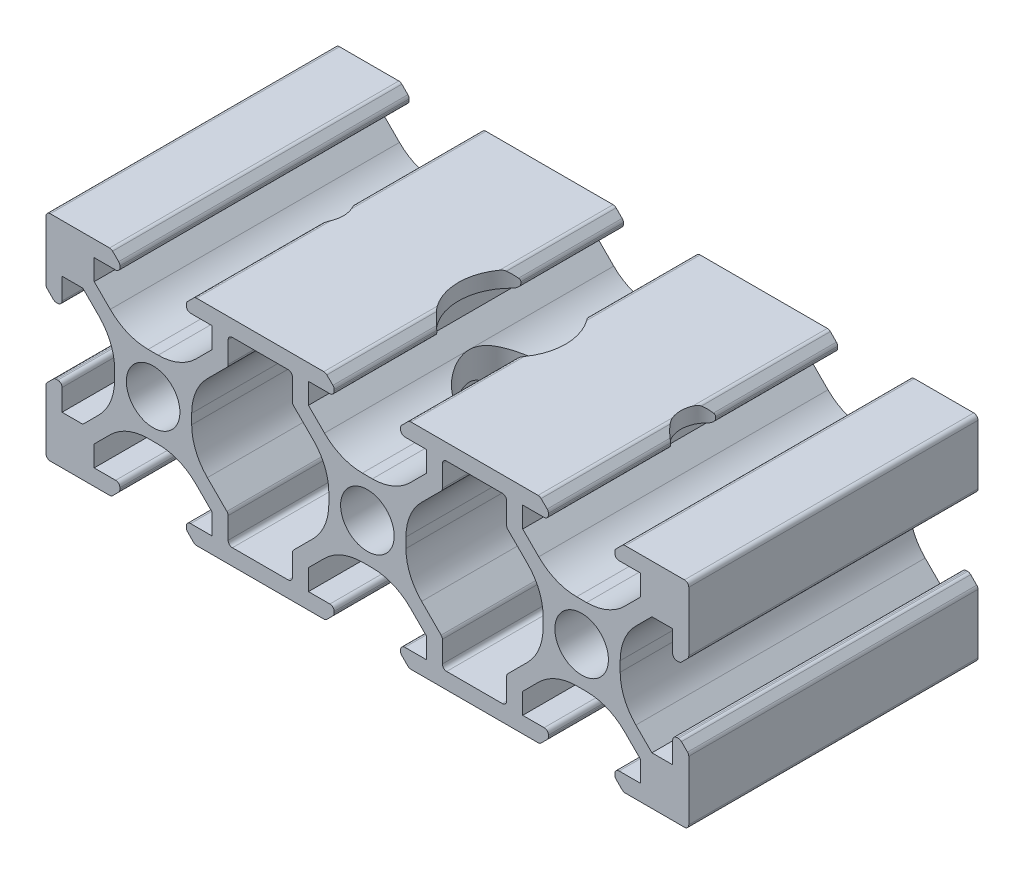
from build123d import *

# Parameters (mm, degrees)
RESSALTO_EXTRUS_O1_DEPTH    = 27
PADR_OCIRCULAR1_COUNT       = 4
PADR_O_LINEAR1_COUNT        = 3
PADR_O_LINEAR1_PITCH        = 20
PADR_O_LINEAR1_COPY_1_DEPTH = 27
PADR_O_LINEAR1_COPY_2_DEPTH = 27
PADR_O_LINEAR1_COPY_3_DEPTH = 27
PADR_O_LINEAR1_COPY_4_DEPTH = 27
PADR_O_LINEAR1_COPY_5_DEPTH = 27
PADR_O_LINEAR1_COPY_6_DEPTH = 27
CORTE_EXTRUS_O1_DEPTH       = 58.697486947
PADR_O_LINEAR2_COUNT        = 2
PADR_O_LINEAR2_PITCH        = 20
FILETE1_R                   = 0.4
FILETE2_R                   = 0.4
SKETCH1_R                   = 5
SKETCH1_R_2                 = 2.5
CUT_EXTRUDE1_DEPTH          = 3
SKETCH2_R                   = 4
CUT_EXTRUDE2_DEPTH          = 61.241181972


with BuildPart() as part:
    # Esboço1 → Ressalto-extrusão1 (new body)
    with BuildSketch(Plane.XY):
        with BuildLine():
            ThreePointArc((-9.317157288, 3.217157288), (-9.187387948, 3.130448187), (-9.034314575, 3.1))
            Line((-9.034314575, 3.1), (-8.9, 3.1))
            ThreePointArc((-8.9, 3.1), (-8.617157288, 3.217157288), (-8.5, 3.5))
            Line((-8.5, 3.5), (-8.5, 5.5))
            Line((-8.5, 5.5), (-6.560660172, 5.5))
            Line((-6.560660172, 5.5), (-5.064466094, 4.003805922))
            ThreePointArc((-5.064466094, 4.003805922), (-3.980602337, 2.381689178), (-3.6, 0.468272016))
            Line((-3.6, 0.468272016), (-3.6, 0))
            Line((-3.6, 0), (-2.5, 0))
            ThreePointArc((-2.5, 0), (-1.767766953, 1.767766953), (0, 2.5))
            Line((0, 2.5), (0, 3.6))
            Line((0, 3.6), (-0.468272016, 3.6))
            ThreePointArc((-0.468272016, 3.6), (-2.381689178, 3.980602337), (-4.003805922, 5.064466094))
            Line((-4.003805922, 5.064466094), (-5.5, 6.560660172))
            Line((-5.5, 6.560660172), (-5.5, 8.5))
            Line((-5.5, 8.5), (-3.5, 8.5))
            ThreePointArc((-3.5, 8.5), (-3.217157288, 8.617157288), (-3.1, 8.9))
            Line((-3.1, 8.9), (-3.1, 9.034314575))
            ThreePointArc((-3.1, 9.034314575), (-3.130448187, 9.187387948), (-3.217157288, 9.317157288))
            Line((-3.217157288, 9.317157288), (-3.782842712, 9.882842712))
            ThreePointArc((-3.782842712, 9.882842712), (-3.912612052, 9.969551813), (-4.065685425, 10))
            Line((-4.065685425, 10), (-10, 10))
            Line((-10, 10), (-10, 4.065685425))
            ThreePointArc((-10, 4.065685425), (-9.969551813, 3.912612052), (-9.882842712, 3.782842712))
            Line((-9.882842712, 3.782842712), (-9.317157288, 3.217157288))
        make_face()
    ressalto_extrus_o1 = extrude(amount=RESSALTO_EXTRUS_O1_DEPTH)

    # PadrãoCircular1: Ressalto-extrusão1 ×4 about axis
    padr_ocircular1_axis = Axis((0, 0, 0), (0, 0, 1))
    for i in range(1, PADR_OCIRCULAR1_COUNT):
        add(ressalto_extrus_o1.rotate(padr_ocircular1_axis, i * 360 / PADR_OCIRCULAR1_COUNT))

    # Padrão linear1: Ressalto-extrusão1 ×3
    with Locations(*[(i * PADR_O_LINEAR1_PITCH, 0, 0) for i in range(1, PADR_O_LINEAR1_COUNT)]):
        add(ressalto_extrus_o1)

    # Padrão linear1 copy 1 sketch → Padrão linear1 copy 1 (add)
    with BuildSketch(Plane(origin=(20, 0, 0), x_dir=(0, 1, 0), z_dir=(0, 0, 1))):
        with BuildLine():
            ThreePointArc((-9.317157288, 3.217157288), (-9.187387948, 3.130448187), (-9.034314575, 3.1))
            Line((-9.034314575, 3.1), (-8.9, 3.1))
            ThreePointArc((-8.9, 3.1), (-8.617157288, 3.217157288), (-8.5, 3.5))
            Line((-8.5, 3.5), (-8.5, 5.5))
            Line((-8.5, 5.5), (-6.560660172, 5.5))
            Line((-6.560660172, 5.5), (-5.064466094, 4.003805922))
            ThreePointArc((-5.064466094, 4.003805922), (-3.980602337, 2.381689178), (-3.6, 0.468272016))
            Line((-3.6, 0.468272016), (-3.6, 0))
            Line((-3.6, 0), (-2.5, 0))
            ThreePointArc((-2.5, 0), (-1.767766953, 1.767766953), (0, 2.5))
            Line((0, 2.5), (0, 3.6))
            Line((0, 3.6), (-0.468272016, 3.6))
            ThreePointArc((-0.468272016, 3.6), (-2.381689178, 3.980602337), (-4.003805922, 5.064466094))
            Line((-4.003805922, 5.064466094), (-5.5, 6.560660172))
            Line((-5.5, 6.560660172), (-5.5, 8.5))
            Line((-5.5, 8.5), (-3.5, 8.5))
            ThreePointArc((-3.5, 8.5), (-3.217157288, 8.617157288), (-3.1, 8.9))
            Line((-3.1, 8.9), (-3.1, 9.034314575))
            ThreePointArc((-3.1, 9.034314575), (-3.130448187, 9.187387948), (-3.217157288, 9.317157288))
            Line((-3.217157288, 9.317157288), (-3.782842712, 9.882842712))
            ThreePointArc((-3.782842712, 9.882842712), (-3.912612052, 9.969551813), (-4.065685425, 10))
            Line((-4.065685425, 10), (-10, 10))
            Line((-10, 10), (-10, 4.065685425))
            ThreePointArc((-10, 4.065685425), (-9.969551813, 3.912612052), (-9.882842712, 3.782842712))
            Line((-9.882842712, 3.782842712), (-9.317157288, 3.217157288))
        make_face()
    extrude(amount=PADR_O_LINEAR1_COPY_1_DEPTH)

    # Padrão linear1 copy 2 sketch → Padrão linear1 copy 2 (add)
    with BuildSketch(Plane(origin=(40, 0, 0), x_dir=(0, 1, 0), z_dir=(0, 0, 1))):
        with BuildLine():
            ThreePointArc((-9.317157288, 3.217157288), (-9.187387948, 3.130448187), (-9.034314575, 3.1))
            Line((-9.034314575, 3.1), (-8.9, 3.1))
            ThreePointArc((-8.9, 3.1), (-8.617157288, 3.217157288), (-8.5, 3.5))
            Line((-8.5, 3.5), (-8.5, 5.5))
            Line((-8.5, 5.5), (-6.560660172, 5.5))
            Line((-6.560660172, 5.5), (-5.064466094, 4.003805922))
            ThreePointArc((-5.064466094, 4.003805922), (-3.980602337, 2.381689178), (-3.6, 0.468272016))
            Line((-3.6, 0.468272016), (-3.6, 0))
            Line((-3.6, 0), (-2.5, 0))
            ThreePointArc((-2.5, 0), (-1.767766953, 1.767766953), (0, 2.5))
            Line((0, 2.5), (0, 3.6))
            Line((0, 3.6), (-0.468272016, 3.6))
            ThreePointArc((-0.468272016, 3.6), (-2.381689178, 3.980602337), (-4.003805922, 5.064466094))
            Line((-4.003805922, 5.064466094), (-5.5, 6.560660172))
            Line((-5.5, 6.560660172), (-5.5, 8.5))
            Line((-5.5, 8.5), (-3.5, 8.5))
            ThreePointArc((-3.5, 8.5), (-3.217157288, 8.617157288), (-3.1, 8.9))
            Line((-3.1, 8.9), (-3.1, 9.034314575))
            ThreePointArc((-3.1, 9.034314575), (-3.130448187, 9.187387948), (-3.217157288, 9.317157288))
            Line((-3.217157288, 9.317157288), (-3.782842712, 9.882842712))
            ThreePointArc((-3.782842712, 9.882842712), (-3.912612052, 9.969551813), (-4.065685425, 10))
            Line((-4.065685425, 10), (-10, 10))
            Line((-10, 10), (-10, 4.065685425))
            ThreePointArc((-10, 4.065685425), (-9.969551813, 3.912612052), (-9.882842712, 3.782842712))
            Line((-9.882842712, 3.782842712), (-9.317157288, 3.217157288))
        make_face()
    extrude(amount=PADR_O_LINEAR1_COPY_2_DEPTH)

    # Padrão linear1 copy 3 sketch → Padrão linear1 copy 3 (add)
    with BuildSketch(Plane(origin=(20, 0, 0), x_dir=(-1, 0, 0), z_dir=(0, 0, 1))):
        with BuildLine():
            ThreePointArc((-9.317157288, 3.217157288), (-9.187387948, 3.130448187), (-9.034314575, 3.1))
            Line((-9.034314575, 3.1), (-8.9, 3.1))
            ThreePointArc((-8.9, 3.1), (-8.617157288, 3.217157288), (-8.5, 3.5))
            Line((-8.5, 3.5), (-8.5, 5.5))
            Line((-8.5, 5.5), (-6.560660172, 5.5))
            Line((-6.560660172, 5.5), (-5.064466094, 4.003805922))
            ThreePointArc((-5.064466094, 4.003805922), (-3.980602337, 2.381689178), (-3.6, 0.468272016))
            Line((-3.6, 0.468272016), (-3.6, 0))
            Line((-3.6, 0), (-2.5, 0))
            ThreePointArc((-2.5, 0), (-1.767766953, 1.767766953), (0, 2.5))
            Line((0, 2.5), (0, 3.6))
            Line((0, 3.6), (-0.468272016, 3.6))
            ThreePointArc((-0.468272016, 3.6), (-2.381689178, 3.980602337), (-4.003805922, 5.064466094))
            Line((-4.003805922, 5.064466094), (-5.5, 6.560660172))
            Line((-5.5, 6.560660172), (-5.5, 8.5))
            Line((-5.5, 8.5), (-3.5, 8.5))
            ThreePointArc((-3.5, 8.5), (-3.217157288, 8.617157288), (-3.1, 8.9))
            Line((-3.1, 8.9), (-3.1, 9.034314575))
            ThreePointArc((-3.1, 9.034314575), (-3.130448187, 9.187387948), (-3.217157288, 9.317157288))
            Line((-3.217157288, 9.317157288), (-3.782842712, 9.882842712))
            ThreePointArc((-3.782842712, 9.882842712), (-3.912612052, 9.969551813), (-4.065685425, 10))
            Line((-4.065685425, 10), (-10, 10))
            Line((-10, 10), (-10, 4.065685425))
            ThreePointArc((-10, 4.065685425), (-9.969551813, 3.912612052), (-9.882842712, 3.782842712))
            Line((-9.882842712, 3.782842712), (-9.317157288, 3.217157288))
        make_face()
    extrude(amount=PADR_O_LINEAR1_COPY_3_DEPTH)

    # Padrão linear1 copy 4 sketch → Padrão linear1 copy 4 (add)
    with BuildSketch(Plane(origin=(40, 0, 0), x_dir=(-1, 0, 0), z_dir=(0, 0, 1))):
        with BuildLine():
            ThreePointArc((-9.317157288, 3.217157288), (-9.187387948, 3.130448187), (-9.034314575, 3.1))
            Line((-9.034314575, 3.1), (-8.9, 3.1))
            ThreePointArc((-8.9, 3.1), (-8.617157288, 3.217157288), (-8.5, 3.5))
            Line((-8.5, 3.5), (-8.5, 5.5))
            Line((-8.5, 5.5), (-6.560660172, 5.5))
            Line((-6.560660172, 5.5), (-5.064466094, 4.003805922))
            ThreePointArc((-5.064466094, 4.003805922), (-3.980602337, 2.381689178), (-3.6, 0.468272016))
            Line((-3.6, 0.468272016), (-3.6, 0))
            Line((-3.6, 0), (-2.5, 0))
            ThreePointArc((-2.5, 0), (-1.767766953, 1.767766953), (0, 2.5))
            Line((0, 2.5), (0, 3.6))
            Line((0, 3.6), (-0.468272016, 3.6))
            ThreePointArc((-0.468272016, 3.6), (-2.381689178, 3.980602337), (-4.003805922, 5.064466094))
            Line((-4.003805922, 5.064466094), (-5.5, 6.560660172))
            Line((-5.5, 6.560660172), (-5.5, 8.5))
            Line((-5.5, 8.5), (-3.5, 8.5))
            ThreePointArc((-3.5, 8.5), (-3.217157288, 8.617157288), (-3.1, 8.9))
            Line((-3.1, 8.9), (-3.1, 9.034314575))
            ThreePointArc((-3.1, 9.034314575), (-3.130448187, 9.187387948), (-3.217157288, 9.317157288))
            Line((-3.217157288, 9.317157288), (-3.782842712, 9.882842712))
            ThreePointArc((-3.782842712, 9.882842712), (-3.912612052, 9.969551813), (-4.065685425, 10))
            Line((-4.065685425, 10), (-10, 10))
            Line((-10, 10), (-10, 4.065685425))
            ThreePointArc((-10, 4.065685425), (-9.969551813, 3.912612052), (-9.882842712, 3.782842712))
            Line((-9.882842712, 3.782842712), (-9.317157288, 3.217157288))
        make_face()
    extrude(amount=PADR_O_LINEAR1_COPY_4_DEPTH)

    # Padrão linear1 copy 5 sketch → Padrão linear1 copy 5 (add)
    with BuildSketch(Plane(origin=(20, 0, 0), x_dir=(0, -1, 0), z_dir=(0, 0, 1))):
        with BuildLine():
            ThreePointArc((-9.317157288, 3.217157288), (-9.187387948, 3.130448187), (-9.034314575, 3.1))
            Line((-9.034314575, 3.1), (-8.9, 3.1))
            ThreePointArc((-8.9, 3.1), (-8.617157288, 3.217157288), (-8.5, 3.5))
            Line((-8.5, 3.5), (-8.5, 5.5))
            Line((-8.5, 5.5), (-6.560660172, 5.5))
            Line((-6.560660172, 5.5), (-5.064466094, 4.003805922))
            ThreePointArc((-5.064466094, 4.003805922), (-3.980602337, 2.381689178), (-3.6, 0.468272016))
            Line((-3.6, 0.468272016), (-3.6, 0))
            Line((-3.6, 0), (-2.5, 0))
            ThreePointArc((-2.5, 0), (-1.767766953, 1.767766953), (0, 2.5))
            Line((0, 2.5), (0, 3.6))
            Line((0, 3.6), (-0.468272016, 3.6))
            ThreePointArc((-0.468272016, 3.6), (-2.381689178, 3.980602337), (-4.003805922, 5.064466094))
            Line((-4.003805922, 5.064466094), (-5.5, 6.560660172))
            Line((-5.5, 6.560660172), (-5.5, 8.5))
            Line((-5.5, 8.5), (-3.5, 8.5))
            ThreePointArc((-3.5, 8.5), (-3.217157288, 8.617157288), (-3.1, 8.9))
            Line((-3.1, 8.9), (-3.1, 9.034314575))
            ThreePointArc((-3.1, 9.034314575), (-3.130448187, 9.187387948), (-3.217157288, 9.317157288))
            Line((-3.217157288, 9.317157288), (-3.782842712, 9.882842712))
            ThreePointArc((-3.782842712, 9.882842712), (-3.912612052, 9.969551813), (-4.065685425, 10))
            Line((-4.065685425, 10), (-10, 10))
            Line((-10, 10), (-10, 4.065685425))
            ThreePointArc((-10, 4.065685425), (-9.969551813, 3.912612052), (-9.882842712, 3.782842712))
            Line((-9.882842712, 3.782842712), (-9.317157288, 3.217157288))
        make_face()
    extrude(amount=PADR_O_LINEAR1_COPY_5_DEPTH)

    # Padrão linear1 copy 6 sketch → Padrão linear1 copy 6 (add)
    with BuildSketch(Plane(origin=(40, 0, 0), x_dir=(0, -1, 0), z_dir=(0, 0, 1))):
        with BuildLine():
            ThreePointArc((-9.317157288, 3.217157288), (-9.187387948, 3.130448187), (-9.034314575, 3.1))
            Line((-9.034314575, 3.1), (-8.9, 3.1))
            ThreePointArc((-8.9, 3.1), (-8.617157288, 3.217157288), (-8.5, 3.5))
            Line((-8.5, 3.5), (-8.5, 5.5))
            Line((-8.5, 5.5), (-6.560660172, 5.5))
            Line((-6.560660172, 5.5), (-5.064466094, 4.003805922))
            ThreePointArc((-5.064466094, 4.003805922), (-3.980602337, 2.381689178), (-3.6, 0.468272016))
            Line((-3.6, 0.468272016), (-3.6, 0))
            Line((-3.6, 0), (-2.5, 0))
            ThreePointArc((-2.5, 0), (-1.767766953, 1.767766953), (0, 2.5))
            Line((0, 2.5), (0, 3.6))
            Line((0, 3.6), (-0.468272016, 3.6))
            ThreePointArc((-0.468272016, 3.6), (-2.381689178, 3.980602337), (-4.003805922, 5.064466094))
            Line((-4.003805922, 5.064466094), (-5.5, 6.560660172))
            Line((-5.5, 6.560660172), (-5.5, 8.5))
            Line((-5.5, 8.5), (-3.5, 8.5))
            ThreePointArc((-3.5, 8.5), (-3.217157288, 8.617157288), (-3.1, 8.9))
            Line((-3.1, 8.9), (-3.1, 9.034314575))
            ThreePointArc((-3.1, 9.034314575), (-3.130448187, 9.187387948), (-3.217157288, 9.317157288))
            Line((-3.217157288, 9.317157288), (-3.782842712, 9.882842712))
            ThreePointArc((-3.782842712, 9.882842712), (-3.912612052, 9.969551813), (-4.065685425, 10))
            Line((-4.065685425, 10), (-10, 10))
            Line((-10, 10), (-10, 4.065685425))
            ThreePointArc((-10, 4.065685425), (-9.969551813, 3.912612052), (-9.882842712, 3.782842712))
            Line((-9.882842712, 3.782842712), (-9.317157288, 3.217157288))
        make_face()
    extrude(amount=PADR_O_LINEAR1_COPY_6_DEPTH)

    # Esboço4 → Corte-extrusão1 (cut, through all)
    with BuildSketch(Plane(origin=(0, 0, 0), x_dir=(-1, 0, 0), z_dir=(0, 0, -1))):
        Polygon((-13.439339828, 5.5), (-13, 5.939339828), (-13, 8.5), (-7, 8.5), (-7, 5.939339828), (-6.560660172, 5.5), (-6.560660172, -5.5), (-7, -5.939339828), (-7, -8.5), (-13, -8.5), (-13, -5.939339828), (-13.439339828, -5.5), align=None)
    corte_extrus_o1 = extrude(amount=-CORTE_EXTRUS_O1_DEPTH, mode=Mode.SUBTRACT)

    # Padrão linear2: Corte-extrusão1 ×2
    with Locations(*[(i * PADR_O_LINEAR2_PITCH, 0, 0) for i in range(1, PADR_O_LINEAR2_COUNT)]):
        add(corte_extrus_o1, mode=Mode.SUBTRACT)

    # Filete1
    filete1_edges = [part.edges().sort_by_distance(p)[0] for p in [
        (13, 5.939339828, 13.5),
        (13, 8.5, 13.5),
        (7, 8.5, 13.5),
        (7, 5.939339828, 13.5),
        (7, -5.939339828, 13.5),
        (7, -8.5, 13.5),
        (13, -8.5, 13.5),
        (13, -5.939339828, 13.5),
        (33, 5.939339828, 13.5),
        (33, 8.5, 13.5),
        (27, 8.5, 13.5),
        (27, 5.939339828, 13.5),
        (27, -5.939339828, 13.5),
        (27, -8.5, 13.5),
        (33, -8.5, 13.5),
        (33, -5.939339828, 13.5),
    ]]
    fillet(filete1_edges, radius=FILETE1_R)

    # Filete2
    filete2_edges = [part.edges().sort_by_distance(p)[0] for p in [
        (-10, 10, 13.5),
        (50, -10, 13.5),
        (50, 10, 13.5),
        (-10, -10, 13.5),
    ]]
    fillet(filete2_edges, radius=FILETE2_R)

    # Sketch1 → Cut-Extrude1 (cut)
    with BuildSketch(Plane(origin=(0, 10, 0), x_dir=(1, 0, 0), z_dir=(0, 1, 0))):
        with Locations((20, -13.5)):
            Circle(SKETCH1_R)
        with Locations((38.25, -13.5)):
            Circle(SKETCH1_R_2)
        with Locations((1.75, -13.5)):
            Circle(SKETCH1_R_2)
    extrude(amount=-CUT_EXTRUDE1_DEPTH, mode=Mode.SUBTRACT)

    # Sketch2 → Cut-Extrude2 (cut, through all)
    with BuildSketch(Plane(origin=(0, 10, 0), x_dir=(1, 0, 0), z_dir=(0, 1, 0))):
        with Locations(Location((20, -13.5, 0), (0, 0, 263.277081222))):
            Circle(SKETCH2_R)
    extrude(amount=-CUT_EXTRUDE2_DEPTH, mode=Mode.SUBTRACT)


solid = part.part
